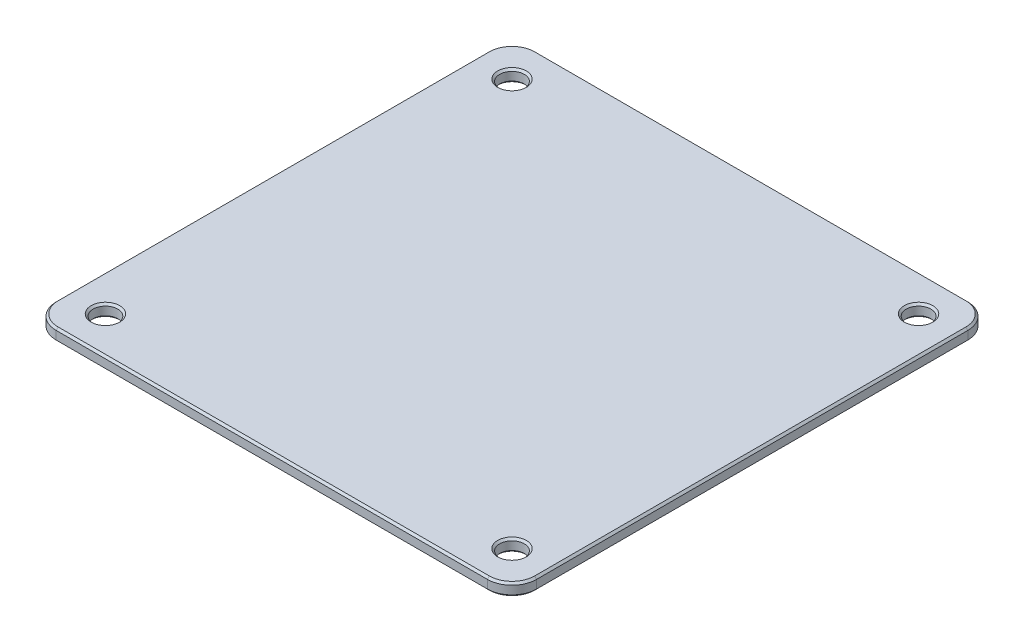
from build123d import *

# Parameters (mm, degrees)
SKETCH2_W           = 61.9125
SKETCH2_H           = 61.9125
SKETCH2_R           = 1.5875
BOSS_EXTRUDE1_DEPTH = 1.5875
FILLET1_R           = 3.175
CHAMFER1_SIZE       = 0.254


with BuildPart() as part:
    # Sketch2 → Boss-Extrude1 (new body)
    with BuildSketch(Plane(origin=(0, 0, 0), x_dir=(1, 0, 0), z_dir=(0, 1, 0))):
        Rectangle(SKETCH2_W, SKETCH2_H)
        with Locations(Location((-26.19375, 26.19375, 0), (0, 0, 270))):
            Circle(SKETCH2_R, mode=Mode.SUBTRACT)
        with Locations(Location((26.19375, 26.19375, 0), (0, 0, 270))):
            Circle(SKETCH2_R, mode=Mode.SUBTRACT)
        with Locations(Location((26.19375, -26.19375, 0), (0, 0, 270))):
            Circle(SKETCH2_R, mode=Mode.SUBTRACT)
        with Locations(Location((-26.19375, -26.19375, 0), (0, 0, 270))):
            Circle(SKETCH2_R, mode=Mode.SUBTRACT)
    extrude(amount=BOSS_EXTRUDE1_DEPTH)

    # Fillet1
    fillet1_edges = [part.edges().sort_by_distance(p)[0] for p in [
        (30.95625, 0.79375, 30.95625),
        (-30.95625, 0.79375, 30.95625),
        (-30.95625, 0.79375, -30.95625),
        (30.95625, 0.79375, -30.95625),
    ]]
    fillet(fillet1_edges, radius=FILLET1_R)

    # Chamfer1
    chamfer1_edges = [part.edges().sort_by_distance(p)[0] for p in [
        (-26.19375, 0, -27.78125),
        (-26.19375, 1.5875, -27.78125),
        (26.19375, 0, -27.78125),
        (26.19375, 1.5875, -27.78125),
        (26.19375, 0, 24.60625),
        (26.19375, 1.5875, 24.60625),
        (-26.19375, 0, 24.60625),
        (-26.19375, 1.5875, 24.60625),
        (30.95625, 0, 0),
        (30.95625, 1.5875, 0),
        (0, 0, 30.95625),
        (-30.95625, 0, 0),
        (0, 0, -30.95625),
        (-30.02631403, 0, 30.02631403),
        (30.02631403, 0, -30.02631403),
        (-30.02631403, 0, -30.02631403),
        (30.02631403, 0, 30.02631403),
        (0, 1.5875, 30.95625),
        (0, 1.5875, -30.95625),
        (-30.95625, 1.5875, 0),
        (-30.02631403, 1.5875, 30.02631403),
        (30.02631403, 1.5875, -30.02631403),
        (-30.02631403, 1.5875, -30.02631403),
        (30.02631403, 1.5875, 30.02631403),
    ]]
    chamfer(chamfer1_edges, length=CHAMFER1_SIZE)


solid = part.part
